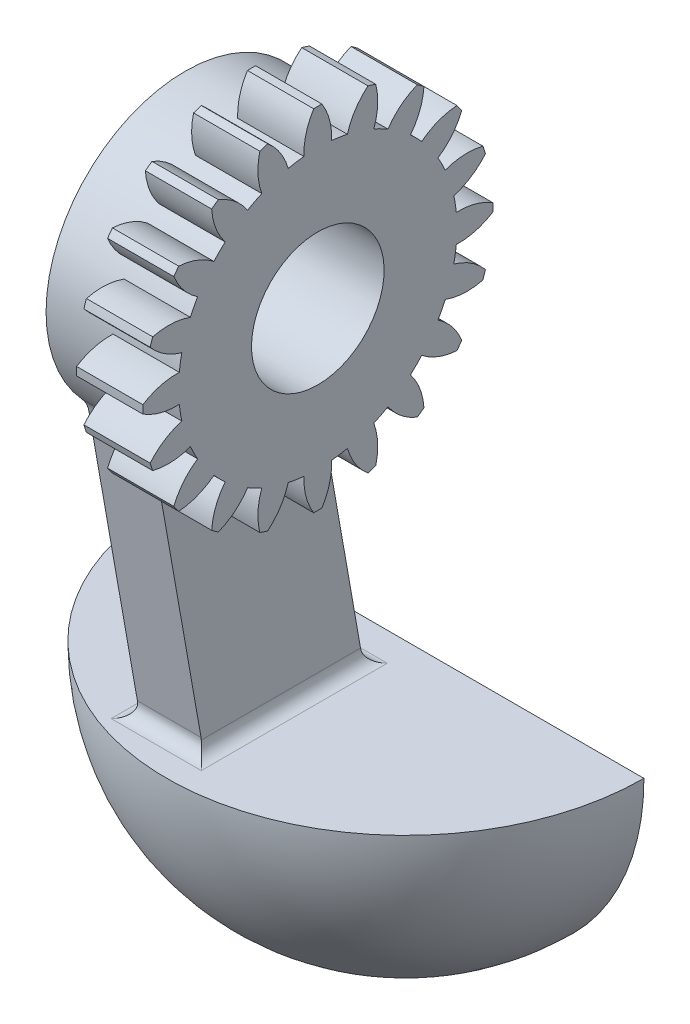
from build123d import *
from build123d.topology import SkipClean

# Parameters (mm, degrees)
BASPROSKE_W               = 2.5
BASPROSKE_H               = 6.6
TOOTHCUT_DEPTH            = 10.662815325
TEETHCUTS_COUNT           = 20
TEETHCUTS_ANGLE           = 342
HUBNEARONE_START          = 2.5000508
HUBNEAONESKE_R            = 5.249
HUBNEARONE_DEPTH          = 2.5000508
BORSKE_R                  = 2.5
BORE_DEPTH                = 5.0000508
MOVE_BODY_1_ANGLE         = 9
REVOLVE_1_ANGLE           = 90
REVOLVE_1_OTHER_WAY_ANGLE = 90
EXTRUDE_1_DEPTH           = 2.4
FILLET_1_R                = 1
FILLET_2_R                = 0.5


with BuildPart() as part:
    # BasProSke → Base-Revolve (revolve)
    with BuildSketch(Plane(origin=(0, 0, 0), x_dir=(1, 0, 0), z_dir=(0, 1, 0)), mode=Mode.PRIVATE) as base_revolve_sk:
        with Locations((1.25, 3.3)):
            Rectangle(BASPROSKE_W, BASPROSKE_H)
    revolve(base_revolve_sk.sketch.rotate(Axis((-10, 0, 0), (1, 0, 0)), 180), axis=Axis((-10, 0, 0), (1, 0, 0)))

    # TooCutSke → ToothCut (cut, through all)
    with BuildSketch(Plane(origin=(0, 0, 0), x_dir=(0, 0, -1), z_dir=(1, 0, 0))):
        with BuildLine():
            ThreePointArc((0.300213811, 5.240407681), (0, 5.249), (-0.300213811, 5.240407681))
            ThreePointArc((-0.300213811, 5.240407681), (-0.497369534, 5.948676387), (-0.899680168, 6.564030831))
            ThreePointArc((-0.899680168, 6.564030831), (0, 6.6254), (0.899680168, 6.564030831))
            ThreePointArc((0.899680168, 6.564030831), (0.497369534, 5.948676387), (0.300213811, 5.240407681))
        make_face()
    toothcut = extrude(amount=TOOTHCUT_DEPTH, mode=Mode.SUBTRACT)

    # TeethCuts: ToothCut ×20 about axis
    teethcuts_axis = Axis((-10, 0, 0), (1, 0, 0))
    for i in range(1, TEETHCUTS_COUNT):
        add(toothcut.rotate(teethcuts_axis, i * TEETHCUTS_ANGLE / (TEETHCUTS_COUNT - 1)), mode=Mode.SUBTRACT)

    # HubNeaOneSke → HubNearOne (add)
    with SkipClean():  # the faces are left unmerged after this step: merging them gives an invalid solid
        with BuildSketch(Plane.ZY.offset(HUBNEARONE_START)):
            Circle(HUBNEAONESKE_R)
        extrude(amount=-HUBNEARONE_DEPTH)

    # BorSke → Bore (cut, symmetric)
    with SkipClean():  # the faces are left unmerged after this step: merging them gives an invalid solid
        with BuildSketch(Plane(origin=(0, 0, 0), x_dir=(0, 0, -1), z_dir=(1, 0, 0))):
            with Locations(Location((0, 0, 0), (0, 0, 180))):
                Circle(BORSKE_R)
        extrude(amount=BORE_DEPTH, both=True, mode=Mode.SUBTRACT)


with BuildPart() as part_1:
    # Move Body 1: moved
    add(part.part.rotate(Axis((0, 0, 0), (-1, 0, 0)), MOVE_BODY_1_ANGLE))



with BuildPart() as body_2:
    # 草图4 → 旋转1 (revolve)
    with BuildSketch(Plane(origin=(0, -5.800690391, 0.605708681), x_dir=(0, 0, -1), z_dir=(1, 0, 0))):
        with BuildLine():
            Line((6.405708681, -9.199309609), (6.405708681, -18.199309609))
            ThreePointArc((6.405708681, -18.199309609), (0.04174765, -15.56327064), (-2.594291319, -9.199309609))
            Line((-2.594291319, -9.199309609), (6.405708681, -9.199309609))
        make_face()
    revolve(axis=Axis((0, -15, -5.8), (0, -1, 0)), revolution_arc=REVOLVE_1_ANGLE)

    # 草图4 → 旋转1 other way (revolve)
    with SkipClean():  # the faces are left unmerged after this step: merging them gives an invalid solid
        with BuildSketch(Plane(origin=(0, -5.800690391, 0.605708681), x_dir=(0, 0, -1), z_dir=(1, 0, 0))):
            with BuildLine():
                Line((6.405708681, -9.199309609), (6.405708681, -18.199309609))
                ThreePointArc((6.405708681, -18.199309609), (0.04174765, -15.56327064), (-2.594291319, -9.199309609))
                Line((-2.594291319, -9.199309609), (6.405708681, -9.199309609))
            make_face()
        revolve(axis=Axis((0, -15, -5.8), (0, 1, 0)), revolution_arc=REVOLVE_1_OTHER_WAY_ANGLE)


with BuildPart() as part_2:
    with SkipClean():  # the faces are left unmerged after this step: merging them gives an invalid solid
        add(part_1.part)

        add(body_2.part)  # 凸台-拉伸1 merges body 2
        # 草图5 → 凸台-拉伸1 (add)
        with BuildSketch(Plane.ZY.offset(2.5000508)):
            with BuildLine():
                Line((-4.3, -15), (-2.38467349, -4.137643583))
                ThreePointArc((-2.38467349, -4.137643583), (0.97980655, -4.674049764), (3.845615938, -2.83160734))
                Line((3.845615938, -2.83160734), (1.7, -15))
                Line((1.7, -15), (-4.3, -15))
            make_face()
        extrude(amount=-EXTRUDE_1_DEPTH)

    # 圆角1
    fillet_1_edges = [part_2.edges().sort_by_distance(p)[0] for p in [
        (-1.3000508, -4.630675276, -2.471608279),
        (-1.3000508, -3.737073108, 3.685957893),
    ]]
    fillet(fillet_1_edges, radius=FILLET_1_R)

    # 圆角2
    fillet_2_edges = [part_2.edges().sort_by_distance(p)[0] for p in [
        (-0.1000508, -15, -1.3),
        (-1.3000508, -15, 1.7),
        (-1.3000508, -15, -4.3),
        (-2.5000508, -15, -1.3),
    ]]
    fillet(fillet_2_edges, radius=FILLET_2_R)


solid = part_2.part
